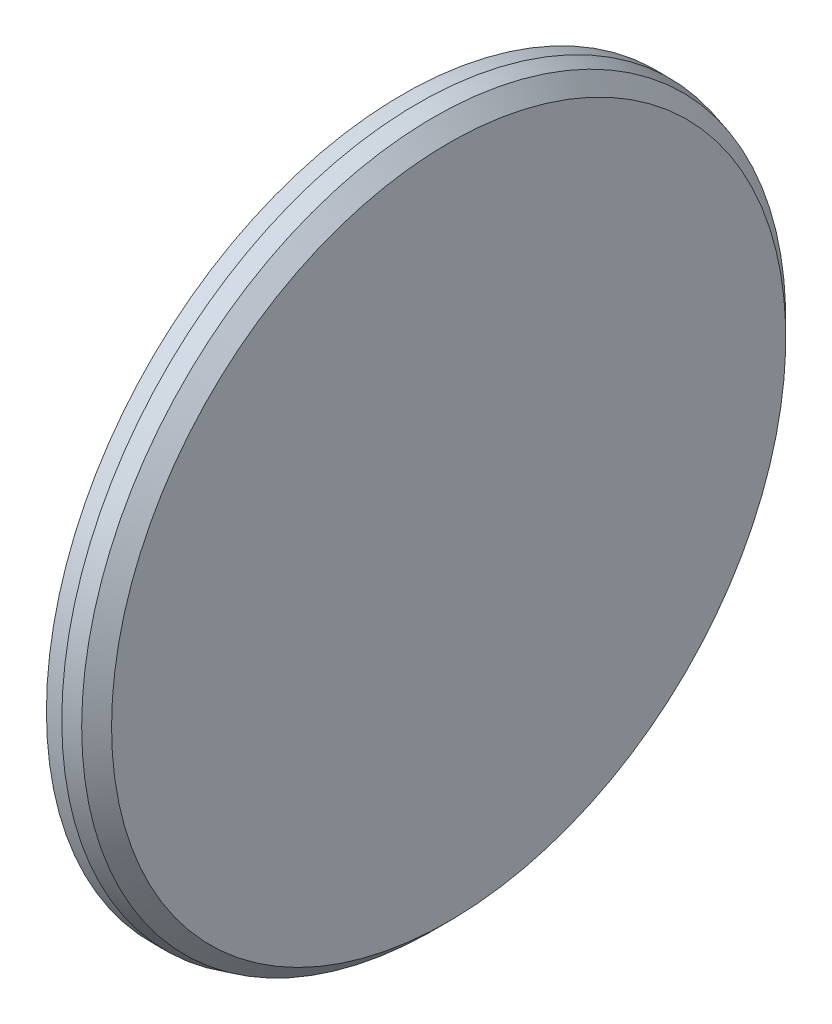
from build123d import *

# Parameters (mm, degrees)
BOSS_EXTRU_1_START           = 20
BOSS_EXTRU_1_DEPTH           = 20
R_P_TITION_CIRCULAIRE1_COUNT = 9


with BuildPart() as part:
    # Esquisse2 → Révolution1 (revolve)
    with BuildSketch(Plane.XY, mode=Mode.PRIVATE) as r_volution1_sk:
        Polygon((19.383892619, 93.684655562), (19.383892619, 48.684655562), (49.383892619, 48.684655562), (49.383892619, -271.315344438), (-0.616107381, -271.315344438), (-0.616107381, -371.315344438), (79.383892619, -371.315344438), (79.383892619, 68.684655562), (59.874273676, 88.194274505), (39.383892619, 93.684655562), align=None)
    revolve(r_volution1_sk.sketch.rotate(Axis((-0.616107381, -371.315344438, 0), (1, 0, 0)), 90), axis=Axis((-0.616107381, -371.315344438, 0), (1, 0, 0)))

    # Esquisse3 → Boss.-Extru.1 (add)
    with BuildSketch(Plane.ZY.offset(-49.383892619).offset(BOSS_EXTRU_1_START)):
        with BuildLine():
            Line((-20, -20.316768943), (-20, -265.485291996))
            ThreePointArc((-20, -265.485291996), (-22.022759648, -271.515518887), (-27.272727273, -275.106205854))
            ThreePointArc((-27.272727273, -275.106205854), (-1.692958106, -271.329676001), (24, -274.238055642))
            ThreePointArc((24, -274.238055642), (25.640038255, -274.65827828), (27.272727273, -275.106205854))
            ThreePointArc((27.272727273, -275.106205854), (22.022759648, -271.515518887), (20, -265.485291996))
            Line((20, -265.485291996), (20, -176.904714545))
            Line((20, -176.904714545), (20, 37.585621567))
            ThreePointArc((20, 37.585621567), (23.192543543, 44.910820307), (30.731707317, 47.55881586))
            ThreePointArc((30.731707317, 47.55881586), (-31.649919519, 47.490437034), (-93.333333333, 38.18299364))
            ThreePointArc((-93.333333333, 38.18299364), (-42.583426132, 26.587388656), (-20, -20.316768943))
        make_face()
    boss_extru_1 = extrude(amount=-BOSS_EXTRU_1_DEPTH)

    # Répétition circulaire1: Boss.-Extru.1 ×9 about axis
    r_p_tition_circulaire1_axis = Axis((0, -371.315344438, 0), (1, 0, 0))
    for i in range(1, R_P_TITION_CIRCULAIRE1_COUNT):
        add(boss_extru_1.rotate(r_p_tition_circulaire1_axis, i * 360 / R_P_TITION_CIRCULAIRE1_COUNT))


solid = part.part
